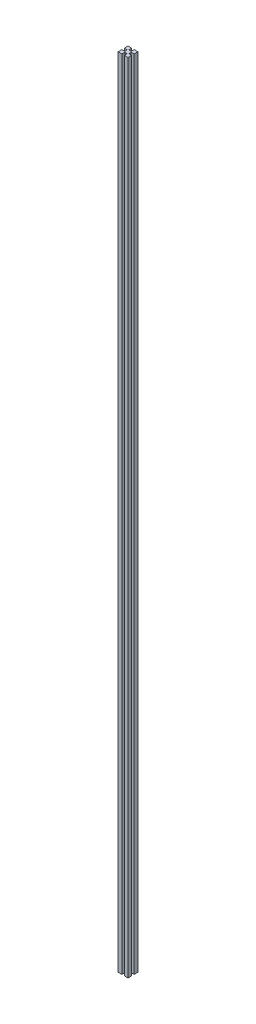
from build123d import *

# Parameters (mm, degrees)
BOSS_EXTRUDE1_DEPTH      = 800.1
BOSS_EXTRUDE1_DEPTH_BACK = 800.1
SKETCH1_W                = 20
SKETCH1_H                = 20
CUT_EXTRUDE1_DEPTH       = 801.224974617
CUT_EXTRUDE1_DEPTH_BACK  = 801.224974617
SKETCH2_W                = 5
SKETCH2_H                = 12
SKETCH2_W_2              = 12
SKETCH2_H_2              = 5


with BuildPart() as part:
    # Sketch1 → Boss-Extrude1 (new, two sides: drawn at the far end of the back side and taken through both)
    with BuildSketch(Plane(origin=(0, 0, 0), x_dir=(1, 0, 0), z_dir=(0, 1, 0)).offset(-BOSS_EXTRUDE1_DEPTH_BACK)):
        Rectangle(SKETCH1_W, SKETCH1_H)
    extrude(amount=BOSS_EXTRUDE1_DEPTH + BOSS_EXTRUDE1_DEPTH_BACK)

    # Sketch2 → Cut-Extrude1 (cut, two sides: drawn at the far end of the back side and taken through both)
    with BuildSketch(Plane(origin=(0, 0, 0), x_dir=(1, 0, 0), z_dir=(0, 1, 0)).offset(-CUT_EXTRUDE1_DEPTH_BACK)):
        with Locations((0, 10)):
            Rectangle(SKETCH2_W, SKETCH2_H)
        with Locations((10, 0)):
            Rectangle(SKETCH2_W_2, SKETCH2_H_2)
        with Locations((-10, 0)):
            Rectangle(SKETCH2_W_2, SKETCH2_H_2)
        with Locations((0, -10)):
            Rectangle(SKETCH2_W, SKETCH2_H)
    extrude(amount=CUT_EXTRUDE1_DEPTH + CUT_EXTRUDE1_DEPTH_BACK, mode=Mode.SUBTRACT)


solid = part.part
